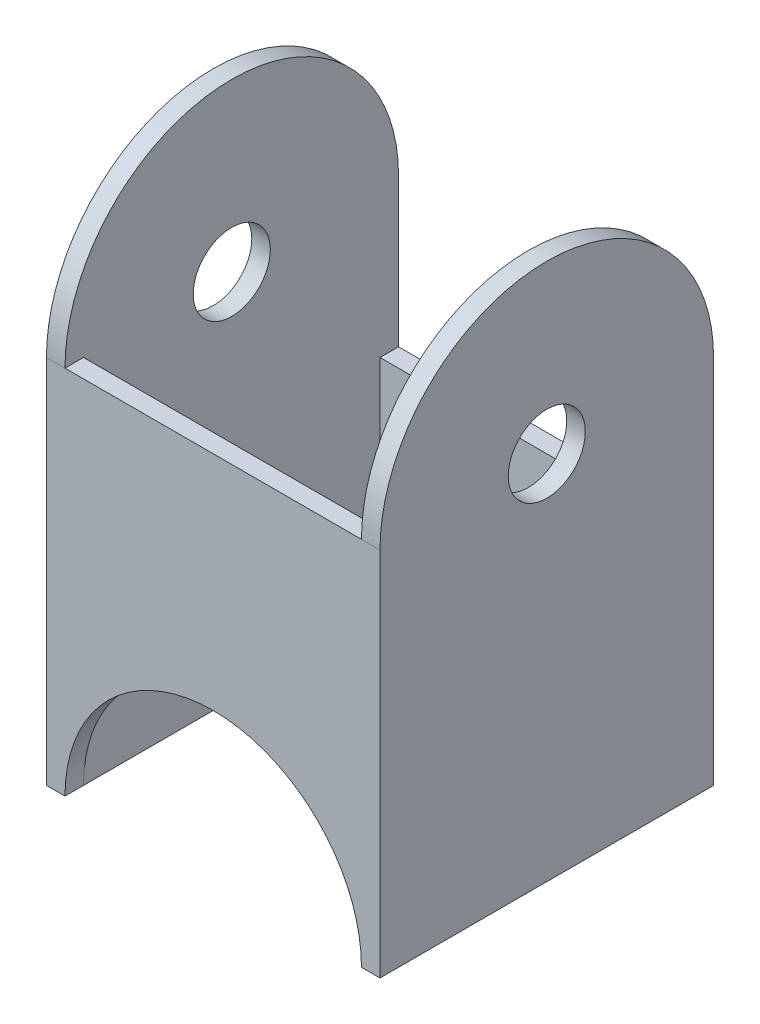
from build123d import *

# Parameters (mm, degrees)
SKETCH1_W               = 28.575
SKETCH1_H               = 28.575
SKETCH1_W_2             = 25.4
SKETCH1_H_2             = 25.4
BOSS_EXTRUDE1_DEPTH     = 31.75
SKETCH2_R               = 14.2875
BOSS_EXTRUDE2_DEPTH     = 1.5875
BOSS_EXTRUDE3_START     = -1.5875
SKETCH3_R               = 14.2875
BOSS_EXTRUDE3_DEPTH     = 1.5875
CUT_EXTRUDE1_DEPTH      = 57.036726238
CUT_EXTRUDE1_DEPTH_BACK = 57.036726238
SKETCH4_R               = 3.302
CUT_EXTRUDE2_DEPTH      = 57.036726238
CUT_EXTRUDE2_DEPTH_BACK = 57.036726238
SKETCH5_R               = 12.7
CUT_EXTRUDE3_REACH      = 57.244
SKETCH6_W               = 25.4
SKETCH6_H               = 12.7


with BuildPart() as part:
    # Sketch1 → Boss-Extrude1 (new body)
    with BuildSketch(Plane(origin=(0, 0, 0), x_dir=(1, 0, 0), z_dir=(0, 1, 0))):
        Rectangle(SKETCH1_W, SKETCH1_H)
        Rectangle(SKETCH1_W_2, SKETCH1_H_2, mode=Mode.SUBTRACT)
    extrude(amount=BOSS_EXTRUDE1_DEPTH)

    # Sketch2 → Boss-Extrude2 (add)
    with BuildSketch(Plane.ZY.offset(14.2875)):
        with Locations((0, 31.75)):
            Circle(SKETCH2_R)
    extrude(amount=-BOSS_EXTRUDE2_DEPTH)

    # Sketch3 → Boss-Extrude3 (add)
    with BuildSketch(Plane(origin=(14.2875, 0, 0), x_dir=(0, 0, -1), z_dir=(1, 0, 0)).offset(BOSS_EXTRUDE3_START)):
        with Locations((0, 31.75)):
            Circle(SKETCH3_R)
    extrude(amount=BOSS_EXTRUDE3_DEPTH)

    # Sketch4 → Cut-Extrude1 (cut, two sides: drawn at the far end of the back side and taken through both)
    with BuildSketch(Plane.ZY.offset(14.2875).offset(-CUT_EXTRUDE1_DEPTH_BACK)):
        with Locations(Location((0, 31.75, 0), (0, 0, 180))):
            Circle(SKETCH4_R)
    extrude(amount=CUT_EXTRUDE1_DEPTH + CUT_EXTRUDE1_DEPTH_BACK, mode=Mode.SUBTRACT)

    # Sketch5 → Cut-Extrude2 (cut, two sides: drawn at the far end of the back side and taken through both)
    with BuildSketch(Plane.XY.offset(14.2875).offset(-CUT_EXTRUDE2_DEPTH_BACK)):
        Circle(SKETCH5_R)
    extrude(amount=CUT_EXTRUDE2_DEPTH + CUT_EXTRUDE2_DEPTH_BACK, mode=Mode.SUBTRACT)

    # Sketch6 → Cut-Extrude3 (cut, up to next)
    with BuildSketch(Plane.XY.offset(-12.7), mode=Mode.PRIVATE) as cut_extrude3_sk1:
        with Locations((0, 25.4)):
            Rectangle(SKETCH6_W, SKETCH6_H)
    cut_extrude3_tool1 = extrude(cut_extrude3_sk1.sketch, amount=-CUT_EXTRUDE3_REACH, mode=Mode.PRIVATE) & part.part
    add(cut_extrude3_tool1.solids().sort_by_distance((0, 25.4, -12.7))[0], mode=Mode.SUBTRACT)


solid = part.part
